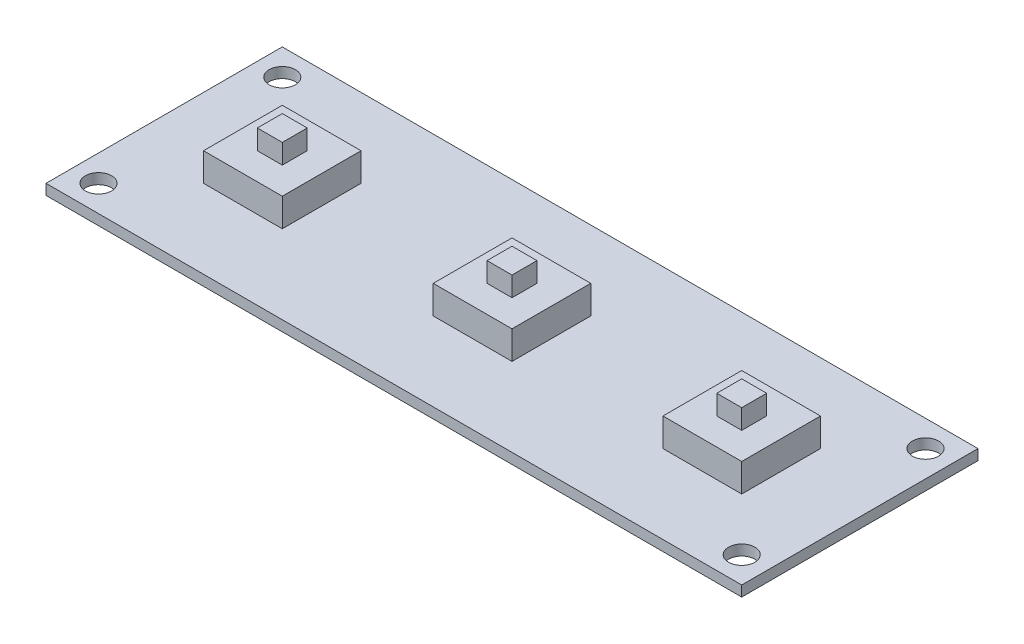
from build123d import *

# Parameters (mm, degrees)
SKETCH1_W           = 12
SKETCH1_H           = 12
BOSS_EXTRUDE1_DEPTH = 4.3
SKETCH2_W           = 3.8
SKETCH2_H           = 3.8
BOSS_EXTRUDE2_DEPTH = 3
SKETCH3_W           = 106
SKETCH3_H           = 36
SKETCH3_R           = 2
BOSS_EXTRUDE3_DEPTH = 1.6
SKETCH4_W           = 12
SKETCH4_H           = 12
BOSS_EXTRUDE4_DEPTH = 4.3
SKETCH5_W           = 3.8
SKETCH5_H           = 3.8
BOSS_EXTRUDE5_DEPTH = 3


with BuildPart() as part:
    # Sketch1 → Boss-Extrude1 (new body)
    with BuildSketch(Plane(origin=(0, 0, 0), x_dir=(1, 0, 0), z_dir=(0, 1, 0))):
        with Locations((6, 6)):
            Rectangle(SKETCH1_W, SKETCH1_H)
    extrude(amount=BOSS_EXTRUDE1_DEPTH)

    # Sketch2 → Boss-Extrude2 (add)
    with BuildSketch(Plane(origin=(0, 4.3, 0), x_dir=(1, 0, 0), z_dir=(0, 1, 0))):
        with Locations((6, 6)):
            Rectangle(SKETCH2_W, SKETCH2_H)
    extrude(amount=BOSS_EXTRUDE2_DEPTH)

    # Sketch3 → Boss-Extrude3 (add)
    with BuildSketch(Plane.XZ):
        with Locations((41, -6)):
            Rectangle(SKETCH3_W, SKETCH3_H)
        with Locations(Location((-8, -20, 0), (0, 0, 270))):
            Circle(SKETCH3_R, mode=Mode.SUBTRACT)
        with Locations(Location((-8, 8, 0), (0, 0, 270))):
            Circle(SKETCH3_R, mode=Mode.SUBTRACT)
        with Locations(Location((90, 8, 0), (0, 0, 270))):
            Circle(SKETCH3_R, mode=Mode.SUBTRACT)
        with Locations(Location((90, -20, 0), (0, 0, 270))):
            Circle(SKETCH3_R, mode=Mode.SUBTRACT)
    extrude(amount=BOSS_EXTRUDE3_DEPTH)

    # Sketch4 → Boss-Extrude4 (add)
    with BuildSketch(Plane(origin=(0, 0, 0), x_dir=(1, 0, 0), z_dir=(0, 1, 0))):
        with Locations((41, 6)):
            Rectangle(SKETCH4_W, SKETCH4_H)
        with Locations((76, 6)):
            Rectangle(SKETCH4_W, SKETCH4_H)
    extrude(amount=BOSS_EXTRUDE4_DEPTH)

    # Sketch5 → Boss-Extrude5 (add)
    with BuildSketch(Plane(origin=(0, 4.3, 0), x_dir=(1, 0, 0), z_dir=(0, 1, 0))):
        with Locations((41, 6)):
            Rectangle(SKETCH5_W, SKETCH5_H)
        with Locations((76, 6)):
            Rectangle(SKETCH5_W, SKETCH5_H)
    extrude(amount=BOSS_EXTRUDE5_DEPTH)


solid = part.part
